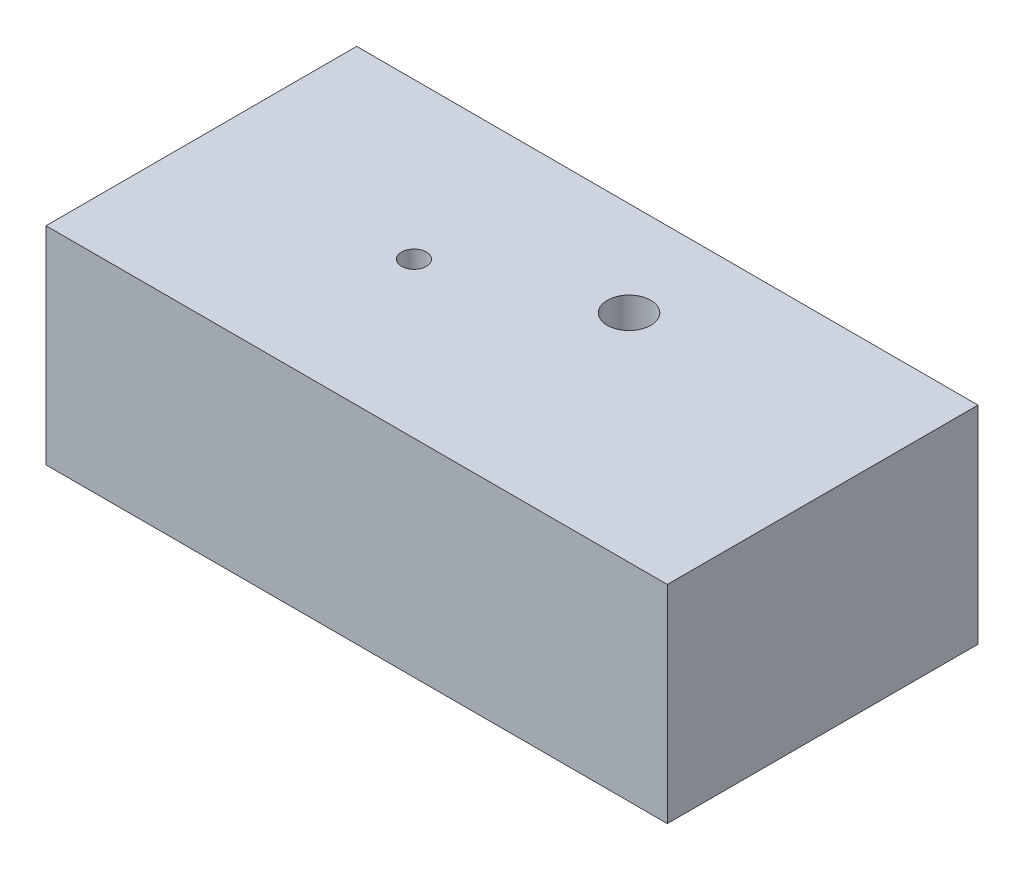
from build123d import *

# Parameters (mm, degrees)
SKETCH1_W           = 30
SKETCH1_H           = 15
SKETCH1_R           = 1.05
SKETCH1_R_2         = 0.6
BOSS_EXTRUDE1_DEPTH = 10


with BuildPart() as part:
    # Sketch1 → Boss-Extrude1 (new body)
    with BuildSketch(Plane(origin=(0, 0, 0), x_dir=(1, 0, 0), z_dir=(0, 1, 0))):
        Rectangle(SKETCH1_W, SKETCH1_H)
        with Locations(Location((2.717632126, 2.935042696, 0), (0, 0, 270))):
            Circle(SKETCH1_R, mode=Mode.SUBTRACT)
        with Locations(Location((-4.718565343, -0.01503649, 0), (0, 0, 270))):
            Circle(SKETCH1_R_2, mode=Mode.SUBTRACT)
    extrude(amount=BOSS_EXTRUDE1_DEPTH)


solid = part.part
